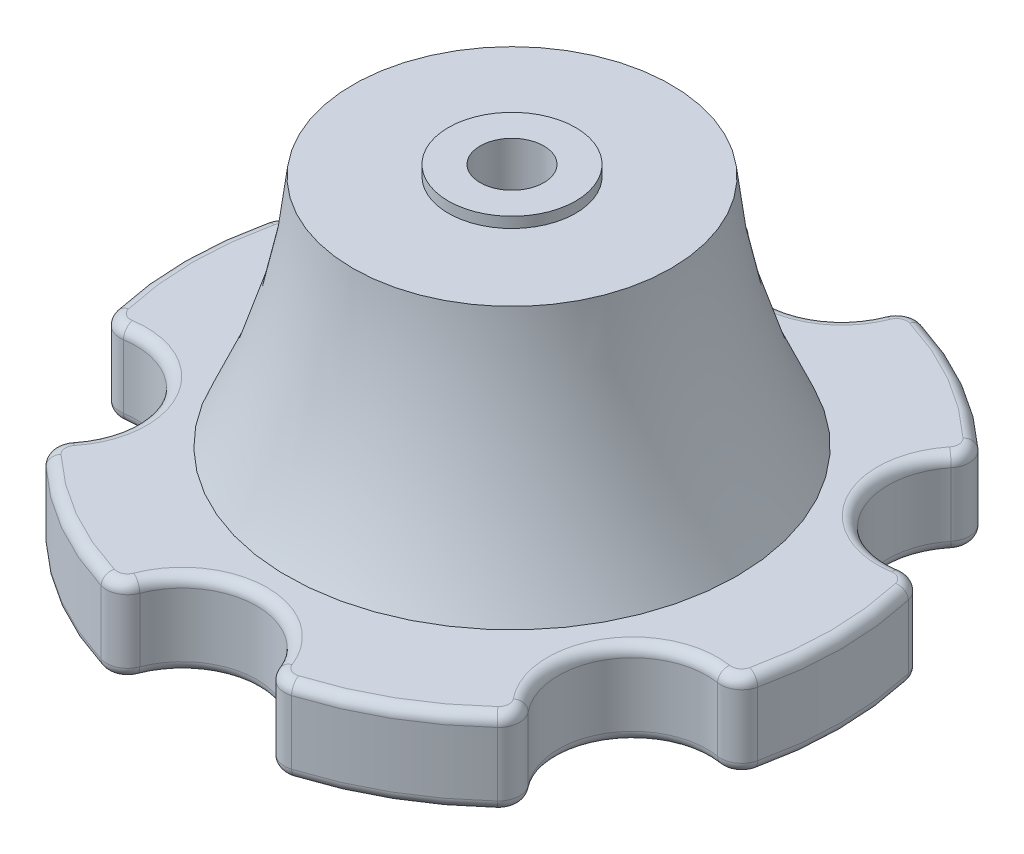
from build123d import *

# Parameters (mm, degrees)
EXTRUDE_1_DEPTH     = 15
SKETCH_3_R          = 1.5
CUT_EXTRUDE_1_DEPTH = 15
CUT_EXTRUDE_2_DEPTH = 4
FILLET_1_R          = 1
FILLET_2_R          = 0.5
SKETCH_5_R          = 3
SKETCH_5_R_2        = 1.5
EXTRUDE_2_DEPTH     = 0.5


with BuildPart() as part:
    # Эскиз1 → Бобышка-Вытянуть1 (new body)
    with BuildSketch(Plane(origin=(0, 0, 0), x_dir=(1, 0, 0), z_dir=(0, 1, 0))):
        with BuildLine():
            ThreePointArc((-3.477707616, 15.135602061), (0, 12.03), (3.477707616, 15.135602061))
            ThreePointArc((3.477707616, 15.135602061), (7.765, 13.449374521), (11.368962078, 10.579584173))
            ThreePointArc((11.368962078, 10.579584173), (10.418285608, 6.015), (14.846669694, 4.556017888))
            ThreePointArc((14.846669694, 4.556017888), (15.53, 0), (14.846669694, -4.556017888))
            ThreePointArc((14.846669694, -4.556017888), (10.418285608, -6.015), (11.368962078, -10.579584173))
            ThreePointArc((11.368962078, -10.579584173), (7.765, -13.449374521), (3.477707616, -15.135602061))
            ThreePointArc((3.477707616, -15.135602061), (0, -12.03), (-3.477707616, -15.135602061))
            ThreePointArc((-3.477707616, -15.135602061), (-7.765, -13.449374521), (-11.368962078, -10.579584173))
            ThreePointArc((-11.368962078, -10.579584173), (-10.418285608, -6.015), (-14.846669694, -4.556017888))
            ThreePointArc((-14.846669694, -4.556017888), (-15.53, 0), (-14.846669694, 4.556017888))
            ThreePointArc((-14.846669694, 4.556017888), (-10.418285608, 6.015), (-11.368962078, 10.579584173))
            ThreePointArc((-11.368962078, 10.579584173), (-7.765, 13.449374521), (-3.477707616, 15.135602061))
        make_face()
    extrude(amount=EXTRUDE_1_DEPTH)

    # Эскиз2 → Вырез-Повернуть1 (revolve, cut)
    with BuildSketch(Plane.XY, mode=Mode.PRIVATE) as cut_revolve_1_sk:
        with BuildLine():
            Line((-15.6, 31), (-15.6, 4))
            Line((-15.6, 4), (-10.6, 4))
            ThreePointArc((-10.6, 4), (-7.390856649, 17.5), (-10.6, 31))
            Line((-10.6, 31), (-15.6, 31))
        make_face()
    revolve(cut_revolve_1_sk.sketch.rotate(Axis((0, -1000, 0), (0, 1, 0)), 180), axis=Axis((0, -1000, 0), (0, 1, 0)), mode=Mode.SUBTRACT)

    # Эскиз3 → Вырез-Вытянуть1 (cut)
    with BuildSketch(Plane.XZ):
        with Locations(Location((0, 0, 0), (0, 0, 270))):
            Circle(SKETCH_3_R)
    extrude(amount=-CUT_EXTRUDE_1_DEPTH, mode=Mode.SUBTRACT)

    # Эскиз4 → Вырез-Вытянуть2 (cut)
    with BuildSketch(Plane.XZ):
        Polygon((1.58771324, 2.75), (-1.58771324, 2.75), (-3.175426481, 0), (-1.58771324, -2.75), (1.58771324, -2.75), (3.175426481, 0), align=None)
    extrude(amount=-CUT_EXTRUDE_2_DEPTH, mode=Mode.SUBTRACT)

    # Скругление1
    fillet_1_edges = [part.edges().sort_by_distance(p)[0] for p in [
        (-3.477707616, 2, -15.135602061),
        (3.477707616, 2, -15.135602061),
        (11.368962078, 2, -10.579584173),
        (14.846669694, 2, -4.556017888),
        (14.846669694, 2, 4.556017888),
        (11.368962078, 2, 10.579584173),
        (3.477707616, 2, 15.135602061),
        (-3.477707616, 2, 15.135602061),
        (-11.368962078, 2, 10.579584173),
        (-14.846669694, 2, 4.556017888),
        (-14.846669694, 2, -4.556017888),
        (-11.368962078, 2, -10.579584173),
    ]]
    fillet(fillet_1_edges, radius=FILLET_1_R)

    # Скругление2
    fillet_2_edges = [part.edges().sort_by_distance(p)[0] for p in [
        (14.704211771, 0, 4.148781611),
        (14.704211771, 0, -4.148781611),
        (10.945056155, 0, -10.659830131),
        (3.759155616, 0, -14.808611742),
        (-10.945056155, 0, -10.659830131),
        (-3.759155616, 0, -14.808611742),
        (0, 4, -12.03),
        (-10.418285608, 4, -6.015),
        (-15.53, 4, 0),
        (-10.418285608, 4, 6.015),
        (-7.765, 4, 13.449374521),
        (0, 4, 12.03),
        (7.765, 4, 13.449374521),
        (10.418285608, 4, 6.015),
        (15.53, 4, 0),
        (10.418285608, 4, -6.015),
        (7.765, 4, -13.449374521),
        (-14.704211771, 4, 4.148781611),
        (-10.945056155, 4, 10.659830131),
        (-14.704211771, 4, -4.148781611),
        (-3.759155616, 4, 14.808611742),
        (3.759155616, 4, 14.808611742),
        (10.945056155, 4, 10.659830131),
        (14.704211771, 4, 4.148781611),
        (14.704211771, 4, -4.148781611),
        (10.945056155, 4, -10.659830131),
        (3.759155616, 4, -14.808611742),
        (-10.945056155, 4, -10.659830131),
        (-3.759155616, 4, -14.808611742),
        (-7.765, 4, -13.449374521),
        (-7.765, 0, -13.449374521),
        (0, 0, -12.03),
        (7.765, 0, -13.449374521),
        (10.418285608, 0, -6.015),
        (15.53, 0, 0),
        (10.418285608, 0, 6.015),
        (7.765, 0, 13.449374521),
        (0, 0, 12.03),
        (-7.765, 0, 13.449374521),
        (-10.418285608, 0, 6.015),
        (-15.53, 0, 0),
        (-10.418285608, 0, -6.015),
        (-14.704211771, 0, 4.148781611),
        (-10.945056155, 0, 10.659830131),
        (-14.704211771, 0, -4.148781611),
        (-3.759155616, 0, 14.808611742),
        (3.759155616, 0, 14.808611742),
        (10.945056155, 0, 10.659830131),
    ]]
    fillet(fillet_2_edges, radius=FILLET_2_R)

    # Эскиз5 → Бобышка-Вытянуть2 (add)
    with BuildSketch(Plane(origin=(0, 15, 0), x_dir=(1, 0, 0), z_dir=(0, 1, 0))):
        with Locations(Location((0, 0, 0), (0, 0, 90))):
            Circle(SKETCH_5_R)
        with Locations(Location((0, 0, 0), (0, 0, 90))):
            Circle(SKETCH_5_R_2, mode=Mode.SUBTRACT)
    extrude(amount=EXTRUDE_2_DEPTH)


solid = part.part
